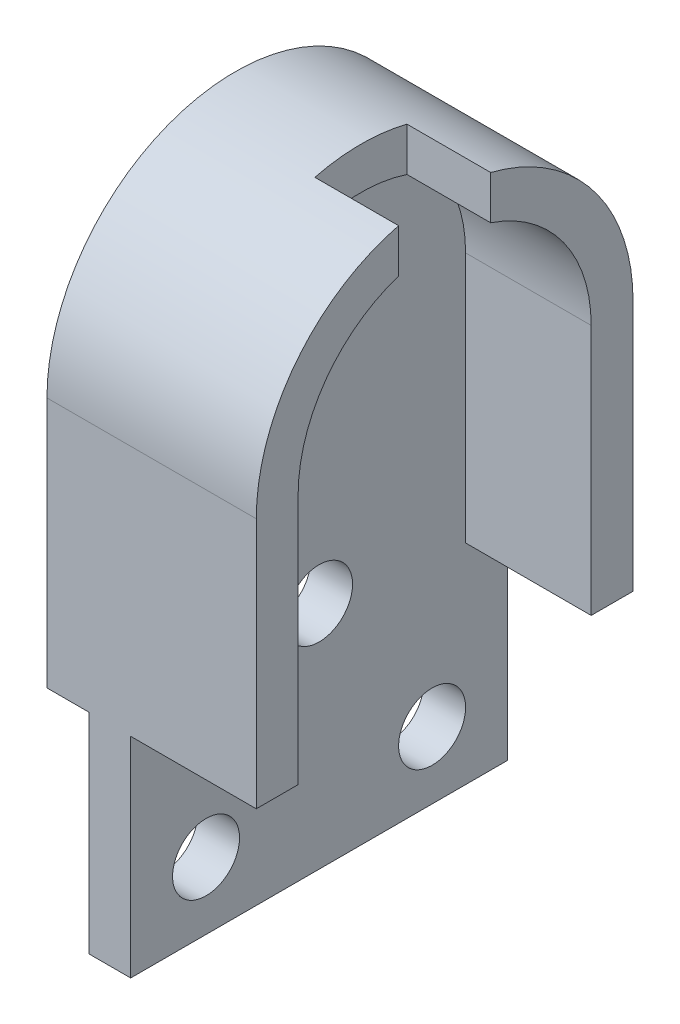
from build123d import *

# Parameters (mm, degrees)
EXTRUDE_1_DEPTH      = 5
EXTRUDE_2_DEPTH      = 20
EXTRUDE_2_DEPTH_BACK = 5
SKETCH_3_R           = 4
CUT_EXTRUDE_2_DEPTH  = 57.844085005
SKETCH_5_W           = 11
SKETCH_5_H           = 15
CUT_EXTRUDE_3_DEPTH  = 10


with BuildPart() as part:
    # Эскиз1 → Бобышка-Вытянуть1 (new body)
    with BuildSketch(Plane(origin=(0, 0, 0), x_dir=(0, 0, -1), z_dir=(1, 0, 0))):
        with BuildLine():
            Line((22.5, -27.5), (22.5, 27.5))
            ThreePointArc((22.5, 27.5), (0, 50), (-22.5, 27.5))
            Line((-22.5, 27.5), (-22.5, -27.5))
            Line((-22.5, -27.5), (22.5, -27.5))
        make_face()
    extrude(amount=EXTRUDE_1_DEPTH)

    # Эскиз1<3> → Бобышка-Вытянуть2 (add, two sides: drawn at the far end of the back side and taken through both)
    with BuildSketch(Plane(origin=(0, 0, 0), x_dir=(0, 0, -1), z_dir=(1, 0, 0)).offset(-EXTRUDE_2_DEPTH_BACK)):
        with BuildLine():
            Line((-17.5, -2.5), (-17.5, 27.5))
            ThreePointArc((-17.5, 27.5), (0, 45), (17.5, 27.5))
            Line((17.5, 27.5), (17.5, -2.5))
            Line((17.5, -2.5), (22.5, -2.5))
            Line((22.5, -2.5), (22.5, 27.5))
            ThreePointArc((22.5, 27.5), (0, 50), (-22.5, 27.5))
            Line((-22.5, 27.5), (-22.5, -2.5))
            Line((-22.5, -2.5), (-17.5, -2.5))
        make_face()
    extrude(amount=EXTRUDE_2_DEPTH + EXTRUDE_2_DEPTH_BACK)

    # Эскиз3 → Вырез-Вытянуть2 (cut, through all)
    with BuildSketch(Plane(origin=(5, 0, 0), x_dir=(0, 0, -1), z_dir=(1, 0, 0))):
        with Locations((-13.5, -19.5)):
            Circle(SKETCH_3_R)
        with Locations((13.5, -19.5)):
            Circle(SKETCH_3_R)
        Circle(SKETCH_3_R)
    extrude(amount=-CUT_EXTRUDE_2_DEPTH, mode=Mode.SUBTRACT)

    # Эскиз5 → Вырез-Вытянуть3 (cut)
    with BuildSketch(Plane(origin=(20, 0, 0), x_dir=(0, 0, -1), z_dir=(1, 0, 0))):
        with Locations((0, 47.5)):
            Rectangle(SKETCH_5_W, SKETCH_5_H)
    extrude(amount=-CUT_EXTRUDE_3_DEPTH, mode=Mode.SUBTRACT)


solid = part.part
